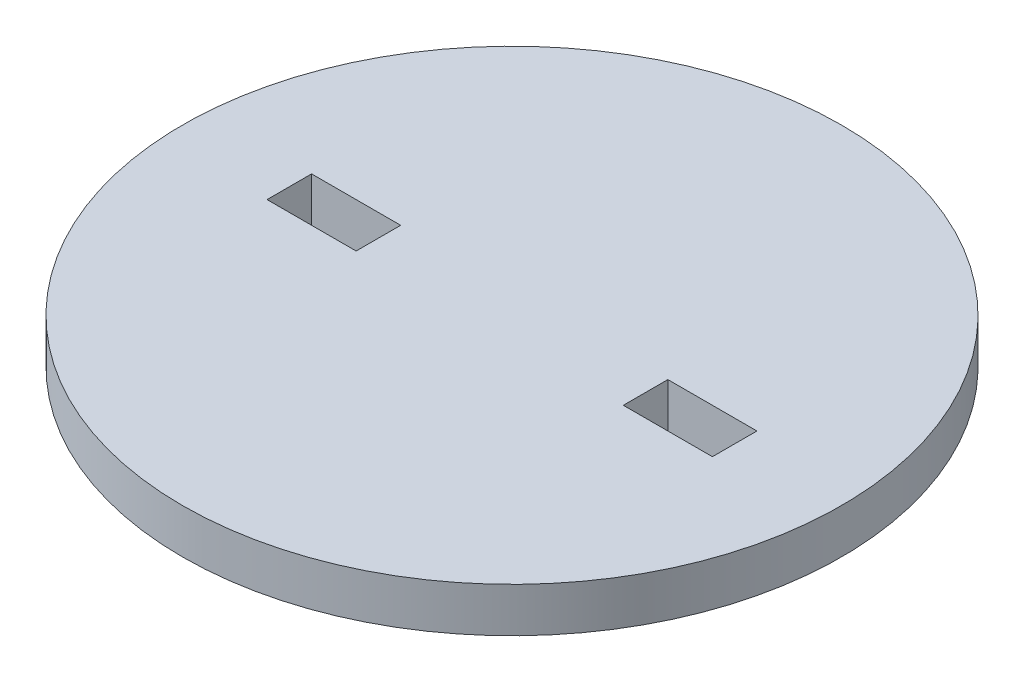
from build123d import *

# Parameters (mm, degrees)
SKETCH1_R           = 23.495
BOSS_EXTRUDE1_DEPTH = 3.175
SKETCH2_W           = 6.35
SKETCH2_H           = 3.175
CUT_EXTRUDE1_DEPTH  = 34.378296466


with BuildPart() as part:
    # Sketch1 → Boss-Extrude1 (new body)
    with BuildSketch(Plane(origin=(0, 0, 0), x_dir=(1, 0, 0), z_dir=(0, 1, 0))):
        with Locations(Location((0, 0, 0), (0, 0, 270))):
            Circle(SKETCH1_R)
    extrude(amount=BOSS_EXTRUDE1_DEPTH)

    # Sketch2 → Cut-Extrude1 (cut, through all)
    with BuildSketch(Plane(origin=(0, 3.175, 0), x_dir=(1, 0, 0), z_dir=(0, 1, 0))):
        with Locations((-12.7, 0)):
            Rectangle(SKETCH2_W, SKETCH2_H)
        with Locations((12.7, 0)):
            Rectangle(SKETCH2_W, SKETCH2_H)
    extrude(amount=-CUT_EXTRUDE1_DEPTH, mode=Mode.SUBTRACT)


solid = part.part
